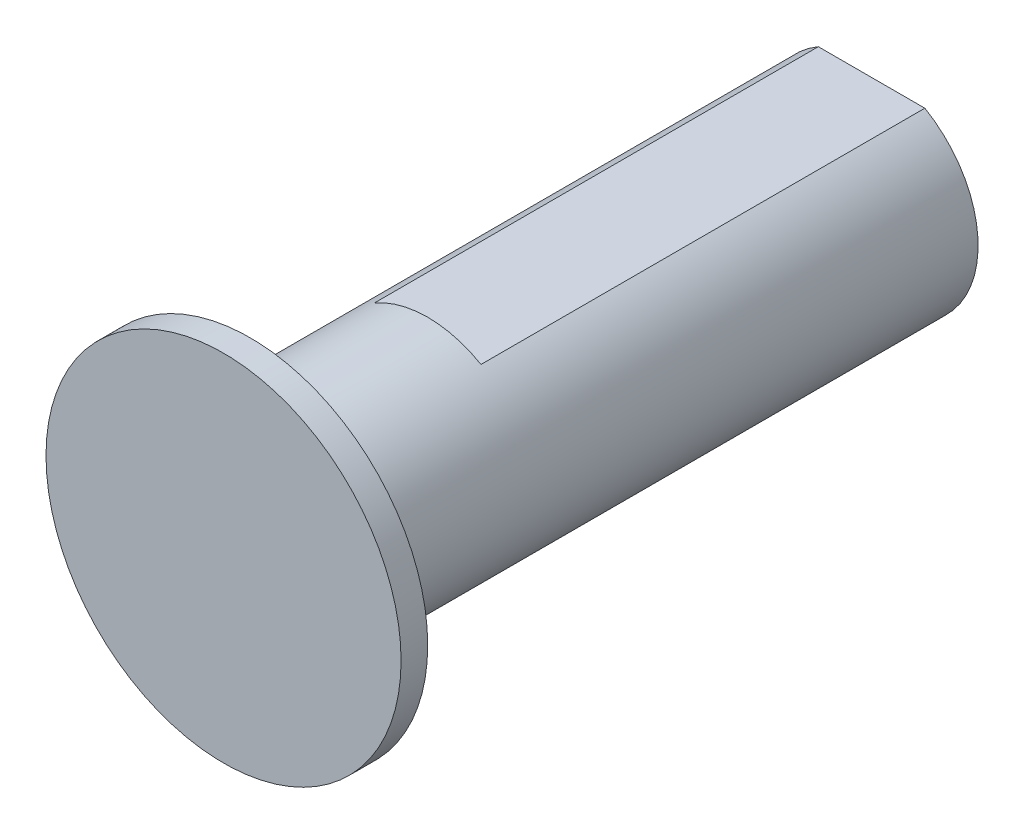
from build123d import *

# Parameters (mm, degrees)
SKETCH1_R           = 6
BOSS_EXTRUDE1_DEPTH = 35
CUT_EXTRUDE1_DEPTH  = 25
SKETCH3_R           = 10
BOSS_EXTRUDE2_DEPTH = 1.5


with BuildPart() as part:
    # Sketch1 → Boss-Extrude1 (new body)
    with BuildSketch(Plane.XY):
        Circle(SKETCH1_R)
    extrude(amount=BOSS_EXTRUDE1_DEPTH)

    # Sketch2 → Cut-Extrude1 (cut)
    with BuildSketch(Plane(origin=(0, 0, 0), x_dir=(-1, 0, 0), z_dir=(0, 0, -1))):
        Polygon((-41.730042052, 5.196152423), (-3, 5.196152423), (3, 5.196152423), (41.730042052, 5.196152423), (41.730042052, 82.656236526), (-41.730042052, 82.656236526), align=None)
    extrude(amount=-CUT_EXTRUDE1_DEPTH, mode=Mode.SUBTRACT)

    # Sketch3 → Boss-Extrude2 (add)
    with BuildSketch(Plane.XY.offset(35)):
        Circle(SKETCH3_R)
    extrude(amount=BOSS_EXTRUDE2_DEPTH)


solid = part.part
